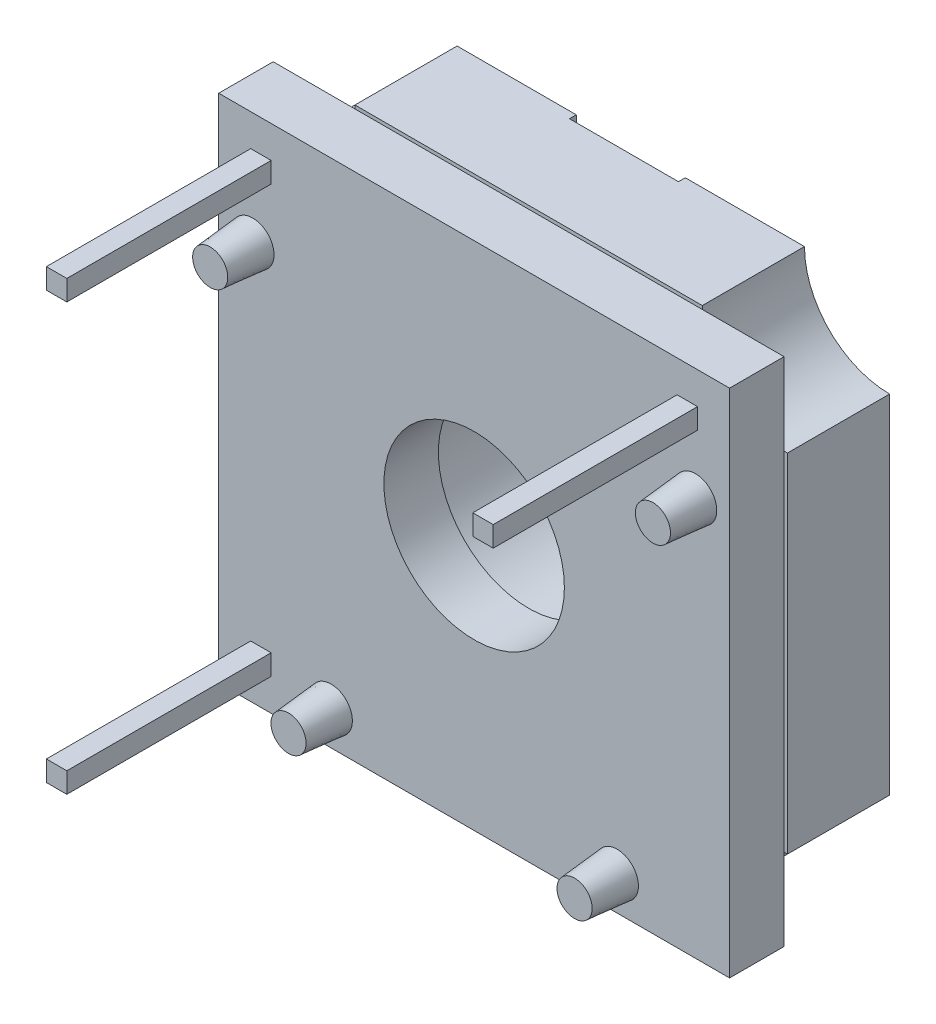
from build123d import *

# Parameters (mm, degrees)
SKETCH1_R                = 3.2
EXTRUDE1_DEPTH           = 3
SKETCH2_W                = 15
SKETCH2_H                = 15
SKETCH2_R                = 2.65
EXTRUDE2_DEPTH           = 1.6
SKETCH3_W                = 0.6
SKETCH3_H                = 0.6
EXTRUDE3_DEPTH           = 6
SKETCH4_R                = 0.625
EXTRUDE4_DEPTH           = 1.25
EXTRUDE4_DRAFT           = 5
EXTRUDE4_PROFILE_2_DEPTH = 1.25
EXTRUDE4_PROFILE_2_DRAFT = 5
EXTRUDE4_PROFILE_3_DEPTH = 1.25
EXTRUDE4_PROFILE_3_DRAFT = 5
EXTRUDE4_PROFILE_4_DEPTH = 1.25
EXTRUDE4_PROFILE_4_DRAFT = 5
CUT_EXTRUDE1_DEPTH       = 0.2


with BuildPart() as part:
    # Sketch1 → Extrude1 (new body)
    with BuildSketch(Plane.XY):
        with BuildLine():
            Line((-5.1, 7.6), (5.1, 7.6))
            ThreePointArc((5.1, 7.6), (5.832233047, 5.832233047), (7.6, 5.1))
            Line((7.6, 5.1), (7.6, -5.1))
            ThreePointArc((7.6, -5.1), (5.832233047, -5.832233047), (5.1, -7.6))
            Line((5.1, -7.6), (-5.1, -7.6))
            ThreePointArc((-5.1, -7.6), (-5.832233047, -5.832233047), (-7.6, -5.1))
            Line((-7.6, -5.1), (-7.6, 5.1))
            ThreePointArc((-7.6, 5.1), (-5.832233047, 5.832233047), (-5.1, 7.6))
        make_face()
        Circle(SKETCH1_R, mode=Mode.SUBTRACT)
    extrude(amount=EXTRUDE1_DEPTH)

    # Sketch2 → Extrude2 (add)
    with BuildSketch(Plane.XY.offset(3)):
        Rectangle(SKETCH2_W, SKETCH2_H)
        Circle(SKETCH2_R, mode=Mode.SUBTRACT)
    extrude(amount=EXTRUDE2_DEPTH)

    # Sketch3 → Extrude3 (add)
    with BuildSketch(Plane.XY.offset(4.6)):
        with Locations((-6.26, 6.26)):
            Rectangle(SKETCH3_W, SKETCH3_H)
        with Locations((6.26, 6.26)):
            Rectangle(SKETCH3_W, SKETCH3_H)
        with Locations((-6.26, -6.26)):
            Rectangle(SKETCH3_W, SKETCH3_H)
    extrude(amount=EXTRUDE3_DEPTH)


with BuildPart() as extrude4_tool:
    # Sketch4 → Extrude4 (with draft: the straight prism first)
    with BuildSketch(Plane.XY.offset(4.6)):
        with Locations((-4.2, -6.5)):
            Circle(SKETCH4_R)
    extrude(amount=EXTRUDE4_DEPTH)
    # Extrude4: the draft: its side faces are tilted about the plane it starts from
    extrude4_sides = [extrude4_tool.faces().sort_by_distance(p)[0] for p in [
        (-4.825, -6.5, 5.225),
    ]]
    draft(extrude4_sides, Plane.XY.offset(4.6), EXTRUDE4_DRAFT)


with BuildPart() as part_1:
    add(part.part)

    # Extrude4: add extrude4_tool
    add(extrude4_tool.part)


with BuildPart() as extrude4_profile_2_tool:
    # Sketch4 → Extrude4 profile 2 (with draft: the straight prism first)
    with BuildSketch(Plane.XY.offset(4.6)):
        with Locations((4.2, -6.5)):
            Circle(SKETCH4_R)
    extrude(amount=EXTRUDE4_PROFILE_2_DEPTH)
    # Extrude4 profile 2: the draft: its side faces are tilted about the plane it starts from
    extrude4_profile_2_sides = [extrude4_profile_2_tool.faces().sort_by_distance(p)[0] for p in [
        (3.575, -6.5, 5.225),
    ]]
    draft(extrude4_profile_2_sides, Plane.XY.offset(4.6), EXTRUDE4_PROFILE_2_DRAFT)


with BuildPart() as part_2:
    add(part_1.part)

    # Extrude4 profile 2: add extrude4_profile_2_tool
    add(extrude4_profile_2_tool.part)


with BuildPart() as extrude4_profile_3_tool:
    # Sketch4 → Extrude4 profile 3 (with draft: the straight prism first)
    with BuildSketch(Plane.XY.offset(4.6)):
        with Locations((-6.5, 4.2)):
            Circle(SKETCH4_R)
    extrude(amount=EXTRUDE4_PROFILE_3_DEPTH)
    # Extrude4 profile 3: the draft: its side faces are tilted about the plane it starts from
    extrude4_profile_3_sides = [extrude4_profile_3_tool.faces().sort_by_distance(p)[0] for p in [
        (-7.125, 4.2, 5.225),
    ]]
    draft(extrude4_profile_3_sides, Plane.XY.offset(4.6), EXTRUDE4_PROFILE_3_DRAFT)


with BuildPart() as part_3:
    add(part_2.part)

    # Extrude4 profile 3: add extrude4_profile_3_tool
    add(extrude4_profile_3_tool.part)


with BuildPart() as extrude4_profile_4_tool:
    # Sketch4 → Extrude4 profile 4 (with draft: the straight prism first)
    with BuildSketch(Plane.XY.offset(4.6)):
        with Locations((6.5, 4.2)):
            Circle(SKETCH4_R)
    extrude(amount=EXTRUDE4_PROFILE_4_DEPTH)
    # Extrude4 profile 4: the draft: its side faces are tilted about the plane it starts from
    extrude4_profile_4_sides = [extrude4_profile_4_tool.faces().sort_by_distance(p)[0] for p in [
        (5.875, 4.2, 5.225),
    ]]
    draft(extrude4_profile_4_sides, Plane.XY.offset(4.6), EXTRUDE4_PROFILE_4_DRAFT)


with BuildPart() as part_4:
    add(part_3.part)

    # Extrude4 profile 4: add extrude4_profile_4_tool
    add(extrude4_profile_4_tool.part)

    # Sketch5 → Cut-Extrude1 (cut)
    with BuildSketch(Plane(origin=(0, 0, 0), x_dir=(-1, 0, 0), z_dir=(0, 0, -1))):
        Polygon((-1.6, 7.6), (1.6, 7.6), (1.6, 7.1), (0.6, 7.1), (0, 6.5), (-0.6, 7.1), (-1.6, 7.1), align=None)
    extrude(amount=-CUT_EXTRUDE1_DEPTH, mode=Mode.SUBTRACT)


solid = part_4.part
